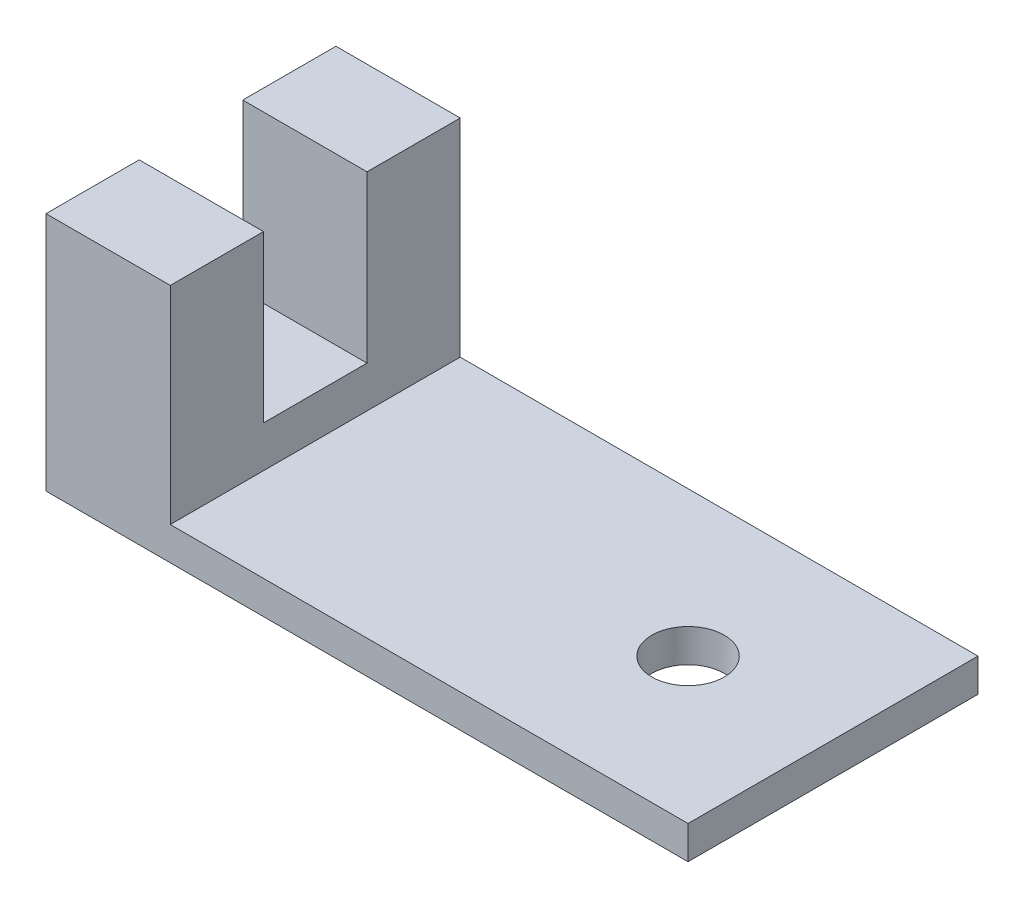
from build123d import *

# Parameters (mm, degrees)
SCHIZZO2_W                   = 31
SCHIZZO2_H                   = 14
ESTRUSIONE_ESTRUSIONE1_DEPTH = 1.6
ESTRUSIONE_ESTRUSIONE2_DEPTH = 6
TAGLIO_ESTRUSIONE1_REACH     = 37.454
SCHIZZO4_R                   = 1.75


with BuildPart() as part:
    # Schizzo2 → Estrusione-Estrusione1 (new body)
    with BuildSketch(Plane(origin=(0, 0, 0), x_dir=(1, 0, 0), z_dir=(0, 1, 0))):
        with Locations((15.5, 7)):
            Rectangle(SCHIZZO2_W, SCHIZZO2_H)
    extrude(amount=ESTRUSIONE_ESTRUSIONE1_DEPTH)

    # Schizzo3 → Estrusione-Estrusione2 (add)
    with BuildSketch(Plane.ZY):
        Polygon((-14, 1.6), (-14, 11.6), (-9.5, 11.6), (-9.5, 3.6), (-4.5, 3.6), (-4.5, 11.6), (0, 11.6), (0, 1.6), align=None)
    extrude(amount=-ESTRUSIONE_ESTRUSIONE2_DEPTH)

    # Schizzo4 → Taglio-Estrusione1 (cut, up to next)
    with BuildSketch(Plane(origin=(0, 1.6, 0), x_dir=(1, 0, 0), z_dir=(0, 1, 0)), mode=Mode.PRIVATE) as taglio_estrusione1_sk1:
        with Locations(Location((24, 7, 0), (0, 0, 270))):
            Circle(SCHIZZO4_R)
    taglio_estrusione1_tool1 = extrude(taglio_estrusione1_sk1.sketch, amount=-TAGLIO_ESTRUSIONE1_REACH, mode=Mode.PRIVATE) & part.part
    add(taglio_estrusione1_tool1.solids().sort_by_distance((24, 1.6, -7))[0], mode=Mode.SUBTRACT)


solid = part.part
